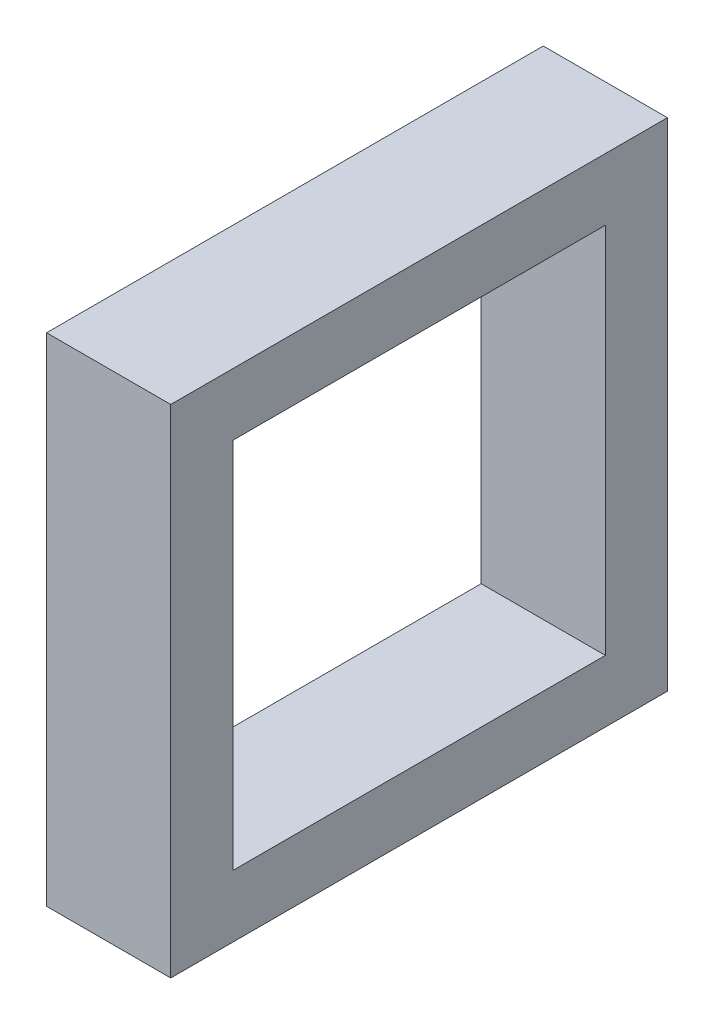
from build123d import *

# Parameters (mm, degrees)
SKETCH_1_W      = 4
SKETCH_1_H      = 4
SKETCH_1_W_2    = 3
SKETCH_1_H_2    = 3
EXTRUDE_1_DEPTH = 1


with BuildPart() as part:
    # 草图1 → 凸台-拉伸1 (new body)
    with BuildSketch(Plane(origin=(0, 0, 0), x_dir=(0, 0, -1), z_dir=(1, 0, 0))):
        Rectangle(SKETCH_1_W, SKETCH_1_H)
        Rectangle(SKETCH_1_W_2, SKETCH_1_H_2, mode=Mode.SUBTRACT)
    extrude(amount=EXTRUDE_1_DEPTH)


solid = part.part
